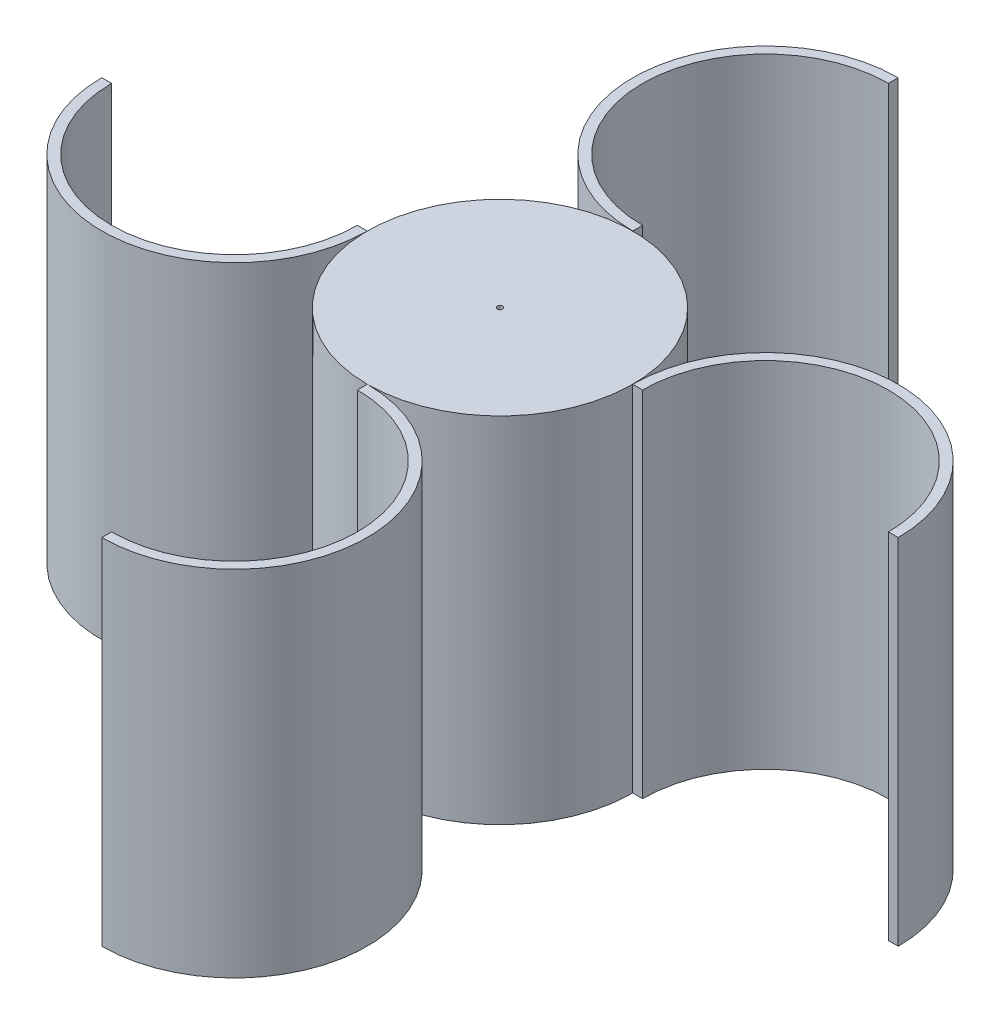
from build123d import *

# Parameters (mm, degrees)
SKETCH1_R           = 7.5
BOSS_EXTRUDE1_DEPTH = 20
SKETCH2_R           = 0.15
CUT_EXTRUDE2_DEPTH  = 20
BOSS_EXTRUDE3_DEPTH = 20


with BuildPart() as part:
    # Sketch1 → Boss-Extrude1 (new body)
    with BuildSketch(Plane(origin=(0, 0, 0), x_dir=(1, 0, 0), z_dir=(0, 1, 0))):
        with Locations(Location((0, 0, 0), (0, 0, 270))):
            Circle(SKETCH1_R)
    extrude(amount=BOSS_EXTRUDE1_DEPTH)

    # Sketch2 → Cut-Extrude2 (cut)
    with BuildSketch(Plane.XZ):
        with Locations(Location((0, 0, 0), (0, 0, 270))):
            Circle(SKETCH2_R)
    extrude(amount=-CUT_EXTRUDE2_DEPTH, mode=Mode.SUBTRACT)


with BuildPart() as body_2:
    # Sketch4 → Boss-Extrude3 (new body)
    with BuildSketch(Plane(origin=(0, 20, 0), x_dir=(1, 0, 0), z_dir=(0, 1, 0))):
        with BuildLine():
            Line((0, 21.945820884), (0, 22.5))
            ThreePointArc((0, 22.5), (-5.929270613, 19.592793268), (-7.261843774, 13.125))
            ThreePointArc((-7.261843774, 13.125), (-7.010737546, 13.260827993), (-6.757091762, 13.391852408))
            ThreePointArc((-6.757091762, 13.391852408), (-5.450428097, 19.305491994), (0, 21.945820884))
        make_face()
        with BuildLine():
            ThreePointArc((-6.757091762, 13.391852408), (-7.010737546, 13.260827993), (-7.261843774, 13.125))
            ThreePointArc((-7.261843774, 13.125), (-4.592793268, 9.070729387), (0, 7.5))
            Line((0, 7.5), (0, 8.054179116))
            ThreePointArc((0, 8.054179116), (-4.305491994, 9.549571903), (-6.757091762, 13.391852408))
        make_face()
        with BuildLine():
            ThreePointArc((-8.054179116, 0), (-9.549571903, -4.305491994), (-13.391852408, -6.757091762))
            ThreePointArc((-13.391852408, -6.757091762), (-13.260827993, -7.010737546), (-13.125, -7.261843774))
            ThreePointArc((-13.125, -7.261843774), (-9.070729387, -4.592793268), (-7.5, 0))
            Line((-7.5, 0), (-8.054179116, 0))
        make_face()
        with BuildLine():
            ThreePointArc((-13.125, -7.261843774), (-13.260827993, -7.010737546), (-13.391852408, -6.757091762))
            ThreePointArc((-13.391852408, -6.757091762), (-19.305491994, -5.450428097), (-21.945820884, 0))
            Line((-21.945820884, 0), (-22.5, 0))
            ThreePointArc((-22.5, 0), (-19.592793268, -5.929270613), (-13.125, -7.261843774))
        make_face()
        with BuildLine():
            ThreePointArc((0, -8.054179116), (4.305491994, -9.549571903), (6.757091762, -13.391852408))
            ThreePointArc((6.757091762, -13.391852408), (7.010737546, -13.260827993), (7.261843774, -13.125))
            ThreePointArc((7.261843774, -13.125), (4.592793268, -9.070729387), (0, -7.5))
            Line((0, -7.5), (0, -8.054179116))
        make_face()
        with BuildLine():
            ThreePointArc((7.261843774, -13.125), (7.010737546, -13.260827993), (6.757091762, -13.391852408))
            ThreePointArc((6.757091762, -13.391852408), (5.450428097, -19.305491994), (0, -21.945820884))
            Line((0, -21.945820884), (0, -22.5))
            ThreePointArc((0, -22.5), (5.929270613, -19.592793268), (7.261843774, -13.125))
        make_face()
        with BuildLine():
            ThreePointArc((13.391852408, 6.757091762), (13.260827993, 7.010737546), (13.125, 7.261843774))
            ThreePointArc((13.125, 7.261843774), (9.070729387, 4.592793268), (7.5, 0))
            Line((7.5, 0), (8.054179116, 0))
            ThreePointArc((8.054179116, 0), (9.549571903, 4.305491994), (13.391852408, 6.757091762))
        make_face()
        with BuildLine():
            ThreePointArc((22.5, 0), (19.592793268, 5.929270613), (13.125, 7.261843774))
            ThreePointArc((13.125, 7.261843774), (13.260827993, 7.010737546), (13.391852408, 6.757091762))
            ThreePointArc((13.391852408, 6.757091762), (19.305491994, 5.450428097), (21.945820884, 0))
            Line((21.945820884, 0), (22.5, 0))
        make_face()
    extrude(amount=-BOSS_EXTRUDE3_DEPTH)


solid = Compound([part.part, body_2.part])
